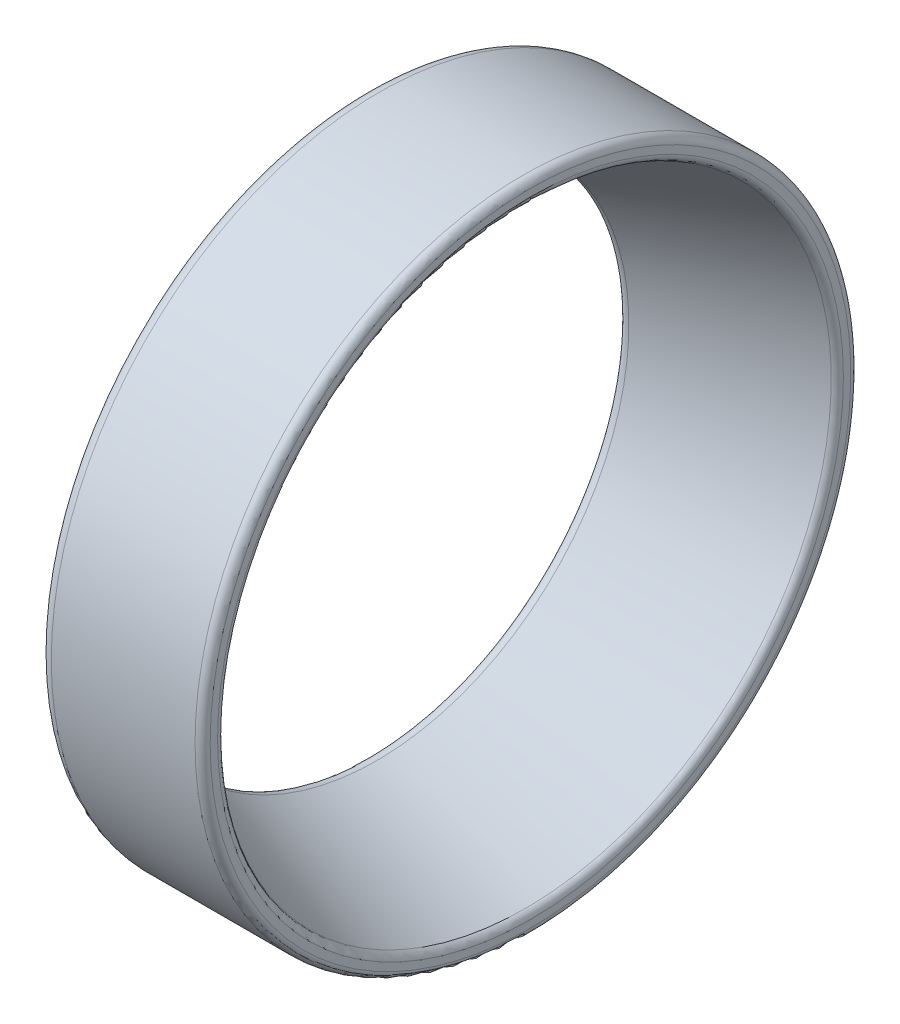
from build123d import *


with BuildPart() as part:
    # Esquisse1 → Base-Révolution (revolve)
    with BuildSketch(Plane.XY, mode=Mode.PRIVATE) as base_r_volution_sk:
        with BuildLine():
            Line((-15.29638585, 26), (-3.89638585, 26))
            ThreePointArc((-3.89638585, 26), (-3.472121782, 25.824264069), (-3.29638585, 25.4))
            Line((-3.29638585, 25.4), (-3.29638585, 24.811004735))
            ThreePointArc((-3.29638585, 24.811004735), (-3.405550409, 24.465924209), (-3.693321081, 24.246412227))
            Line((-3.693321081, 24.246412227), (-15.493321081, 20.002352589))
            ThreePointArc((-15.493321081, 20.002352589), (-16.041466376, 20.076109655), (-16.29638585, 20.566945096))
            Line((-16.29638585, 20.566945096), (-16.29638585, 25))
            ThreePointArc((-16.29638585, 25), (-16.003492631, 25.707106781), (-15.29638585, 26))
        make_face()
    revolve(base_r_volution_sk.sketch.rotate(Axis((-17.990056753, 0, 0), (1, 0, 0)), 90), axis=Axis((-17.990056753, 0, 0), (1, 0, 0)))


solid = part.part
